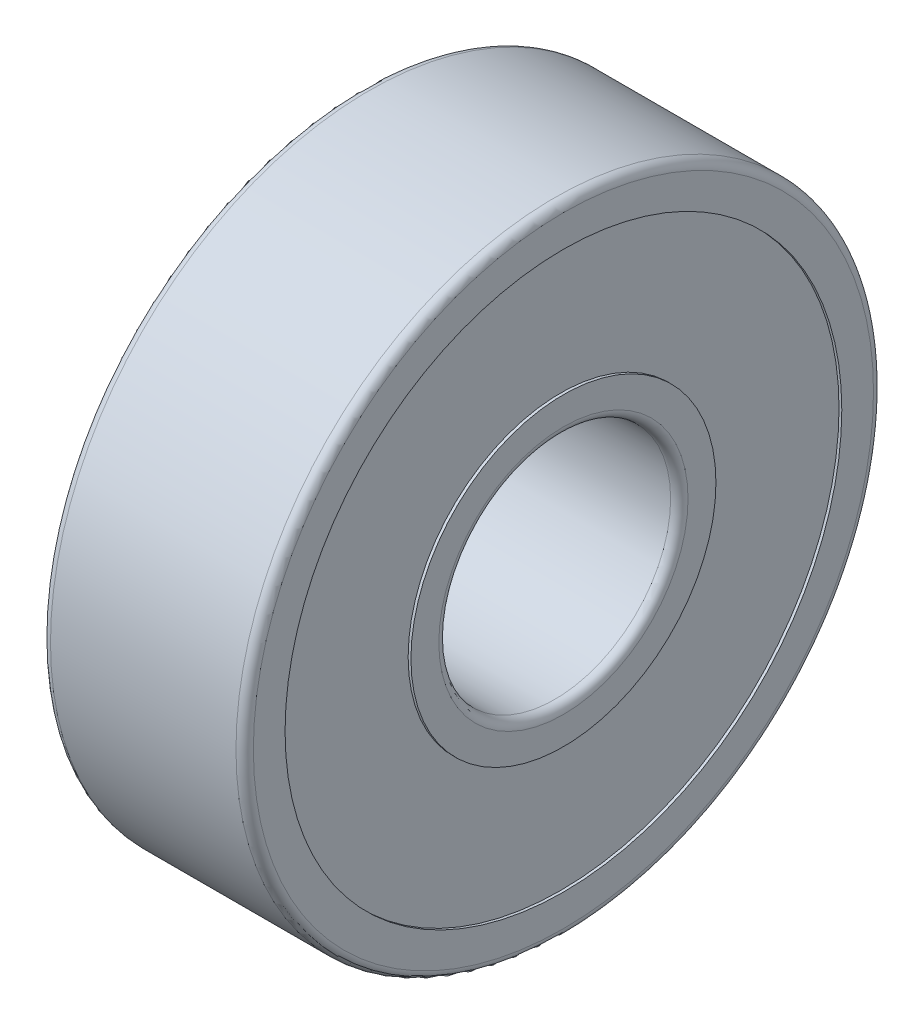
from build123d import *


with BuildPart() as part:
    # Sketch1 → Revolve1 (revolve)
    with BuildSketch(Plane(origin=(0, 0, 0), x_dir=(-1, 0, 0), z_dir=(0, 0, -1)), mode=Mode.PRIVATE) as revolve1_sk:
        with BuildLine():
            Line((-6.7, 4), (-0.3, 4))
            ThreePointArc((-0.3, 4), (-0.087867966, 4.087867966), (0, 4.3))
            Line((0, 4.3), (0, 5.2629))
            Line((0, 5.2629), (-0.0956, 5.2629))
            Line((-0.0956, 5.2629), (-0.0956, 9.6056))
            Line((-0.0956, 9.6056), (0, 9.6056))
            Line((0, 9.6056), (0, 10.7))
            ThreePointArc((0, 10.7), (-0.087867966, 10.912132034), (-0.3, 11))
            Line((-0.3, 11), (-6.7, 11))
            ThreePointArc((-6.7, 11), (-6.912132034, 10.912132034), (-7, 10.7))
            Line((-7, 10.7), (-7, 9.6056))
            Line((-7, 9.6056), (-6.9044, 9.6056))
            Line((-6.9044, 9.6056), (-6.9044, 5.2629))
            Line((-6.9044, 5.2629), (-7, 5.2629))
            Line((-7, 5.2629), (-7, 4.3))
            ThreePointArc((-7, 4.3), (-6.912132034, 4.087867966), (-6.7, 4))
        make_face()
    revolve(revolve1_sk.sketch.rotate(Axis((7.003537608, 0, 0), (-1, 0, 0)), 270), axis=Axis((7.003537608, 0, 0), (-1, 0, 0)))


solid = part.part
